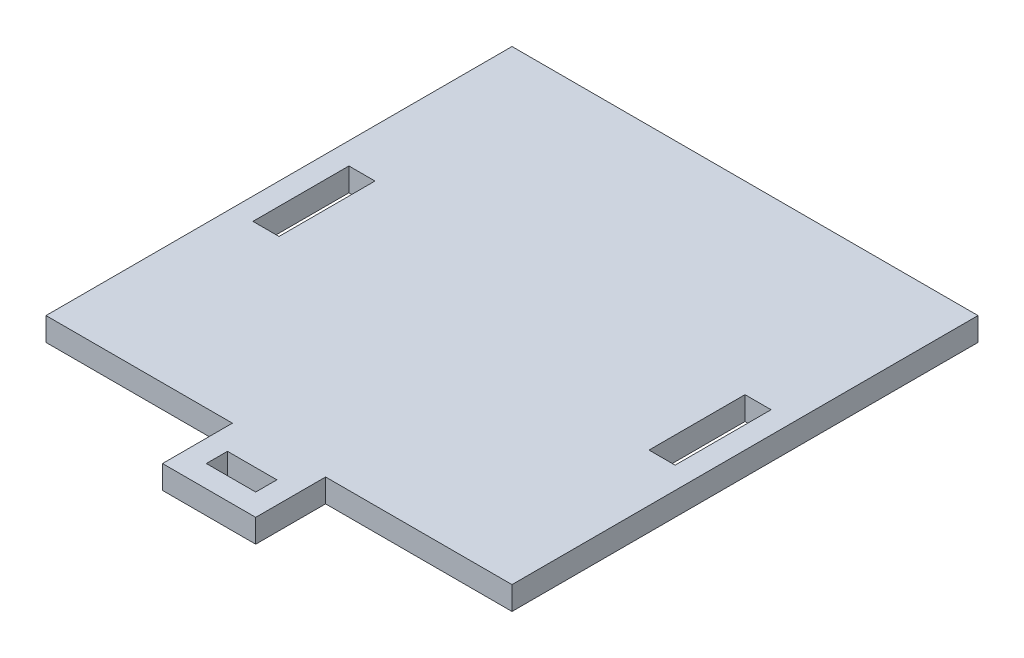
from build123d import *

# Parameters (mm, degrees)
SKETCH1_W           = 5.6
SKETCH1_H           = 20.6
SKETCH1_W_2         = 10.6
SKETCH1_H_2         = 4.543049558
BOSS_EXTRUDE1_DEPTH = 5


with BuildPart() as part:
    # Sketch1 → Boss-Extrude1 (new body)
    with BuildSketch(Plane(origin=(0, 0, 0), x_dir=(1, 0, 0), z_dir=(0, 1, 0))):
        Polygon((0, 0), (100, 0), (100, -100), (60, -100), (60, -115), (40, -115), (40, -100), (0, -100), align=None)
        with Locations((7.5, -50)):
            Rectangle(SKETCH1_W, SKETCH1_H, mode=Mode.SUBTRACT)
        with Locations((92.5, -50)):
            Rectangle(SKETCH1_W, SKETCH1_H, mode=Mode.SUBTRACT)
        with Locations((50, -108.028475221)):
            Rectangle(SKETCH1_W_2, SKETCH1_H_2, mode=Mode.SUBTRACT)
    extrude(amount=BOSS_EXTRUDE1_DEPTH)


solid = part.part
